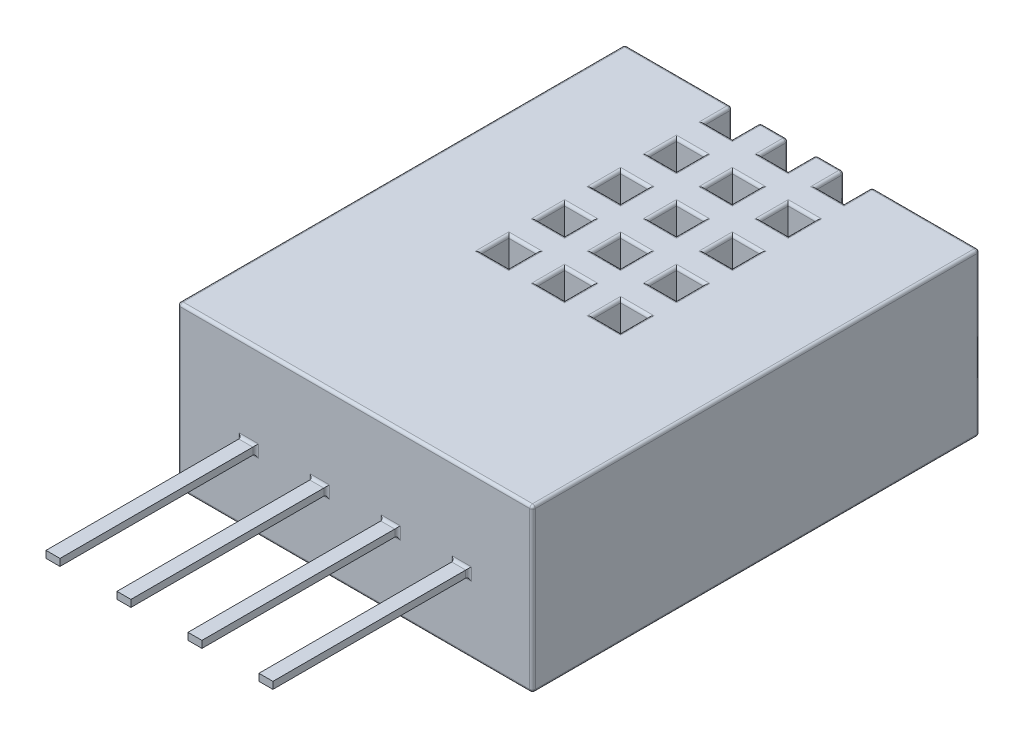
from build123d import *

# Parameters (mm, degrees)
SKETCH1_W                     = 12.7
SKETCH1_H                     = 16
BOSS_EXTRUDE1_DEPTH           = 5.8
SKETCH2_W                     = 1
SKETCH2_H                     = 1
CUT_EXTRUDE2_DEPTH            = 2
LPATTERN1_COUNT               = 5
LPATTERN1_PITCH               = 2
LPATTERN2_COUNT               = 2
LPATTERN2_PITCH               = 2
LPATTERN2_COPY_1_SKETCH_W     = 1
LPATTERN2_COPY_1_SKETCH_H     = 1
LPATTERN2_COPY_1_DEPTH        = 2
LPATTERN2_COPY_2_SKETCH_W     = 1
LPATTERN2_COPY_2_SKETCH_H     = 1
LPATTERN2_COPY_2_DEPTH        = 2
LPATTERN2_COPY_3_SKETCH_W     = 1
LPATTERN2_COPY_3_SKETCH_H     = 1
LPATTERN2_COPY_3_DEPTH        = 2
LPATTERN2_COPY_4_SKETCH_W     = 1
LPATTERN2_COPY_4_SKETCH_H     = 1
LPATTERN2_COPY_4_DEPTH        = 2
LPATTERN2_COL_COUNT           = 2
LPATTERN2_COL_PITCH           = 2
LPATTERN2_COL_COPY_1_SKETCH_W = 1
LPATTERN2_COL_COPY_1_SKETCH_H = 1
LPATTERN2_COL_COPY_1_DEPTH    = 2
LPATTERN2_COL_COPY_2_SKETCH_W = 1
LPATTERN2_COL_COPY_2_SKETCH_H = 1
LPATTERN2_COL_COPY_2_DEPTH    = 2
LPATTERN2_COL_COPY_3_SKETCH_W = 1
LPATTERN2_COL_COPY_3_SKETCH_H = 1
LPATTERN2_COL_COPY_3_DEPTH    = 2
LPATTERN2_COL_COPY_4_SKETCH_W = 1
LPATTERN2_COL_COPY_4_SKETCH_H = 1
LPATTERN2_COL_COPY_4_DEPTH    = 2
SKETCH3_W                     = 0.5
SKETCH3_H                     = 0.25
BOSS_EXTRUDE2_DEPTH           = 7
FILLET1_R                     = 0.1


with BuildPart() as part:
    # Sketch1 → Boss-Extrude1 (new body)
    with BuildSketch(Plane(origin=(0, 0, 0), x_dir=(1, 0, 0), z_dir=(0, 1, 0))):
        Rectangle(SKETCH1_W, SKETCH1_H)
    extrude(amount=BOSS_EXTRUDE1_DEPTH)

    # Sketch2 → Cut-Extrude2 (cut)
    with BuildSketch(Plane(origin=(0, 5.8, 0), x_dir=(1, 0, 0), z_dir=(0, 1, 0))):
        with Locations((0, 7.5)):
            Rectangle(SKETCH2_W, SKETCH2_H)
    cut_extrude2 = extrude(amount=-CUT_EXTRUDE2_DEPTH, mode=Mode.SUBTRACT)

    # LPattern1: Cut-Extrude2 ×5
    with Locations(*[(0, 0, i * LPATTERN1_PITCH) for i in range(1, LPATTERN1_COUNT)]):
        add(cut_extrude2, mode=Mode.SUBTRACT)

    # LPattern2: Cut-Extrude2 ×2
    with Locations(*[(-i * LPATTERN2_PITCH, 0, 0) for i in range(1, LPATTERN2_COUNT)]):
        add(cut_extrude2, mode=Mode.SUBTRACT)

    # LPattern2 copy 1 sketch → LPattern2 copy 1 (cut)
    with BuildSketch(Plane(origin=(-2, 5.8, 2), x_dir=(1, 0, 0), z_dir=(0, 1, 0))):
        with Locations((0, 7.5)):
            Rectangle(LPATTERN2_COPY_1_SKETCH_W, LPATTERN2_COPY_1_SKETCH_H)
    extrude(amount=-LPATTERN2_COPY_1_DEPTH, mode=Mode.SUBTRACT)

    # LPattern2 copy 2 sketch → LPattern2 copy 2 (cut)
    with BuildSketch(Plane(origin=(-2, 5.8, 4), x_dir=(1, 0, 0), z_dir=(0, 1, 0))):
        with Locations((0, 7.5)):
            Rectangle(LPATTERN2_COPY_2_SKETCH_W, LPATTERN2_COPY_2_SKETCH_H)
    extrude(amount=-LPATTERN2_COPY_2_DEPTH, mode=Mode.SUBTRACT)

    # LPattern2 copy 3 sketch → LPattern2 copy 3 (cut)
    with BuildSketch(Plane(origin=(-2, 5.8, 6), x_dir=(1, 0, 0), z_dir=(0, 1, 0))):
        with Locations((0, 7.5)):
            Rectangle(LPATTERN2_COPY_3_SKETCH_W, LPATTERN2_COPY_3_SKETCH_H)
    extrude(amount=-LPATTERN2_COPY_3_DEPTH, mode=Mode.SUBTRACT)

    # LPattern2 copy 4 sketch → LPattern2 copy 4 (cut)
    with BuildSketch(Plane(origin=(-2, 5.8, 8), x_dir=(1, 0, 0), z_dir=(0, 1, 0))):
        with Locations((0, 7.5)):
            Rectangle(LPATTERN2_COPY_4_SKETCH_W, LPATTERN2_COPY_4_SKETCH_H)
    extrude(amount=-LPATTERN2_COPY_4_DEPTH, mode=Mode.SUBTRACT)

    # LPattern2 col: Cut-Extrude2 ×2
    with Locations(*[(i * LPATTERN2_COL_PITCH, 0, 0) for i in range(1, LPATTERN2_COL_COUNT)]):
        add(cut_extrude2, mode=Mode.SUBTRACT)

    # LPattern2 col copy 1 sketch → LPattern2 col copy 1 (cut)
    with BuildSketch(Plane(origin=(2, 5.8, 2), x_dir=(1, 0, 0), z_dir=(0, 1, 0))):
        with Locations((0, 7.5)):
            Rectangle(LPATTERN2_COL_COPY_1_SKETCH_W, LPATTERN2_COL_COPY_1_SKETCH_H)
    extrude(amount=-LPATTERN2_COL_COPY_1_DEPTH, mode=Mode.SUBTRACT)

    # LPattern2 col copy 2 sketch → LPattern2 col copy 2 (cut)
    with BuildSketch(Plane(origin=(2, 5.8, 4), x_dir=(1, 0, 0), z_dir=(0, 1, 0))):
        with Locations((0, 7.5)):
            Rectangle(LPATTERN2_COL_COPY_2_SKETCH_W, LPATTERN2_COL_COPY_2_SKETCH_H)
    extrude(amount=-LPATTERN2_COL_COPY_2_DEPTH, mode=Mode.SUBTRACT)

    # LPattern2 col copy 3 sketch → LPattern2 col copy 3 (cut)
    with BuildSketch(Plane(origin=(2, 5.8, 6), x_dir=(1, 0, 0), z_dir=(0, 1, 0))):
        with Locations((0, 7.5)):
            Rectangle(LPATTERN2_COL_COPY_3_SKETCH_W, LPATTERN2_COL_COPY_3_SKETCH_H)
    extrude(amount=-LPATTERN2_COL_COPY_3_DEPTH, mode=Mode.SUBTRACT)

    # LPattern2 col copy 4 sketch → LPattern2 col copy 4 (cut)
    with BuildSketch(Plane(origin=(2, 5.8, 8), x_dir=(1, 0, 0), z_dir=(0, 1, 0))):
        with Locations((0, 7.5)):
            Rectangle(LPATTERN2_COL_COPY_4_SKETCH_W, LPATTERN2_COL_COPY_4_SKETCH_H)
    extrude(amount=-LPATTERN2_COL_COPY_4_DEPTH, mode=Mode.SUBTRACT)

    # Sketch3 → Boss-Extrude2 (add)
    with BuildSketch(Plane.XY.offset(8)):
        with Locations((-1.27, 2.625)):
            Rectangle(SKETCH3_W, SKETCH3_H)
        with Locations((-3.81, 2.625)):
            Rectangle(SKETCH3_W, SKETCH3_H)
        with Locations((1.27, 2.625)):
            Rectangle(SKETCH3_W, SKETCH3_H)
        with Locations((3.81, 2.625)):
            Rectangle(SKETCH3_W, SKETCH3_H)
    extrude(amount=BOSS_EXTRUDE2_DEPTH)

    # Fillet1
    fillet1_edges = [part.edges().sort_by_distance(p)[0] for p in [
        (2.5, 5.8, -7.5),
        (2.5, 4.8, -8),
        (2, 3.8, -8),
        (1.5, 4.8, -8),
        (1.5, 5.8, -7.5),
        (2, 5.8, -7),
        (2.5, 5.8, -5.5),
        (2, 5.8, -6),
        (1.5, 5.8, -5.5),
        (2, 5.8, -5),
        (2.5, 5.8, -3.5),
        (2, 5.8, -4),
        (1.5, 5.8, -3.5),
        (2, 5.8, -3),
        (2.5, 5.8, -1.5),
        (-6.35, 5.8, 0),
        (2, 5.8, -2),
        (1.5, 5.8, -1.5),
        (2, 5.8, -1),
        (2.5, 5.8, 0.5),
        (2, 5.8, 0),
        (1.5, 5.8, 0.5),
        (2, 5.8, 1),
        (-1, 5.8, -8),
        (-4.425, 5.8, -8),
        (0, 5.8, 8),
        (-1.5, 5.8, -7.5),
        (-1.5, 4.8, -8),
        (-2, 3.8, -8),
        (-2.5, 4.8, -8),
        (-2.5, 5.8, -7.5),
        (-2, 5.8, -7),
        (-1.5, 5.8, -5.5),
        (0.5, 5.8, -7.5),
        (-2, 5.8, -6),
        (-2.5, 5.8, -5.5),
        (-2, 5.8, -5),
        (0.5, 4.8, -8),
        (-1.5, 5.8, -3.5),
        (-2, 5.8, -4),
        (-2.5, 5.8, -3.5),
        (-2, 5.8, -3),
        (-1.5, 5.8, -1.5),
        (0, 3.8, -8),
        (-2, 5.8, -2),
        (-2.5, 5.8, -1.5),
        (-2, 5.8, -1),
        (-0.5, 4.8, -8),
        (-1.5, 5.8, 0.5),
        (-2, 5.8, 0),
        (-2.5, 5.8, 0.5),
        (-2, 5.8, 1),
        (-0.5, 5.8, -7.5),
        (0, 5.8, -7),
        (-3.56, 2.625, 8),
        (-3.81, 2.75, 8),
        (-4.06, 2.625, 8),
        (-3.81, 2.5, 8),
        (-1.27, 2.5, 8),
        (-1.02, 2.625, 8),
        (-1.27, 2.75, 8),
        (-1.52, 2.625, 8),
        (1.27, 2.5, 8),
        (1.52, 2.625, 8),
        (1.27, 2.75, 8),
        (1.02, 2.625, 8),
        (3.81, 2.5, 8),
        (4.06, 2.625, 8),
        (3.81, 2.75, 8),
        (3.56, 2.625, 8),
        (0.5, 5.8, -5.5),
        (0, 5.8, -6),
        (-0.5, 5.8, -5.5),
        (0, 5.8, -5),
        (0.5, 5.8, -3.5),
        (0, 5.8, -4),
        (-0.5, 5.8, -3.5),
        (0, 5.8, -3),
        (6.35, 5.8, 0),
        (0, 0, 8),
        (0.5, 5.8, -1.5),
        (0, 5.8, -2),
        (-6.35, 0, 0),
        (-0.5, 5.8, -1.5),
        (0, 5.8, -1),
        (0, 0, -8),
        (0.5, 5.8, 0.5),
        (0, 5.8, 0),
        (-0.5, 5.8, 0.5),
        (0, 5.8, 1),
        (6.35, 0, 0),
        (6.35, 2.9, 8),
        (-6.35, 2.9, 8),
        (-6.35, 2.9, -8),
        (6.35, 2.9, -8),
        (4.425, 5.8, -8),
        (1, 5.8, -8),
    ]]
    fillet(fillet1_edges, radius=FILLET1_R)


solid = part.part
